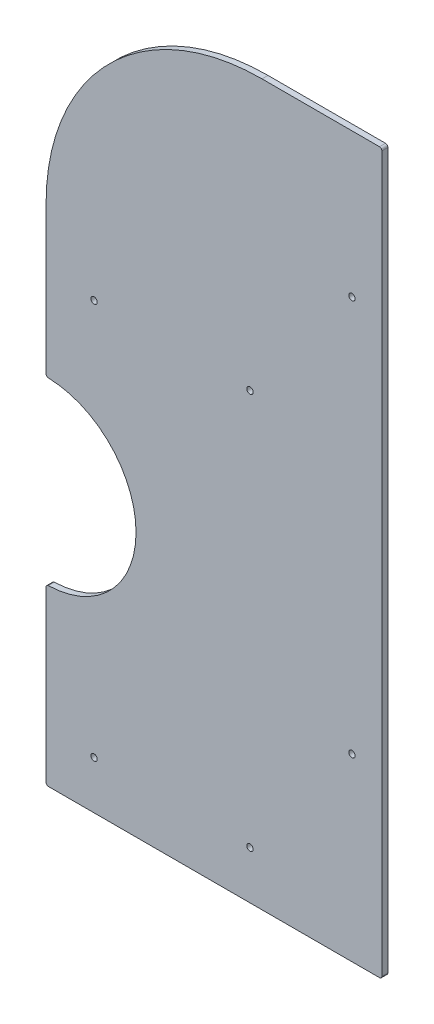
from build123d import *

# Parameters (mm, degrees)
SKETCH1_W           = 355.6
SKETCH1_H           = 762
BOSS_EXTRUDE1_DEPTH = 6.35
FILLET1_R           = 228.6
SKETCH3_R           = 95.25
CUT_EXTRUDE1_DEPTH  = 421.492761531
SKETCH2_R           = 3.3734375
CUT_EXTRUDE2_DEPTH  = 421.492761531
FILLET2_R           = 2.54


with BuildPart() as part:
    # Sketch1 → Boss-Extrude1 (new body)
    with BuildSketch(Plane.XY):
        Rectangle(SKETCH1_W, SKETCH1_H)
    extrude(amount=BOSS_EXTRUDE1_DEPTH)

    # Fillet1
    fillet1_edges = [part.edges().sort_by_distance(p)[0] for p in [
        (-177.8, 381, 3.175),
    ]]
    fillet(fillet1_edges, radius=FILLET1_R)

    # Sketch3 → Cut-Extrude1 (cut, through all)
    with BuildSketch(Plane.XY.offset(6.35)):
        with Locations((-177.8, -101.6)):
            Circle(SKETCH3_R)
    extrude(amount=-CUT_EXTRUDE1_DEPTH, mode=Mode.SUBTRACT)

    # Sketch2 → Cut-Extrude2 (cut, through all)
    with BuildSketch(Plane.XY.offset(6.35)):
        with Locations((146.05, 228.6)):
            Circle(SKETCH2_R)
        with Locations((38.1, 88.9)):
            Circle(SKETCH2_R)
        with Locations((-127, 88.9)):
            Circle(SKETCH2_R)
        with Locations((146.05, -190.5)):
            Circle(SKETCH2_R)
        with Locations((38.1, -330.2)):
            Circle(SKETCH2_R)
        with Locations((-127, -330.2)):
            Circle(SKETCH2_R)
    extrude(amount=-CUT_EXTRUDE2_DEPTH, mode=Mode.SUBTRACT)

    # Fillet2
    fillet2_edges = [part.edges().sort_by_distance(p)[0] for p in [
        (-177.8, -6.35, 3.175),
        (-177.8, -196.85, 3.175),
        (177.8, -381, 3.175),
        (-177.8, -381, 3.175),
        (177.8, 381, 3.175),
    ]]
    fillet(fillet2_edges, radius=FILLET2_R)


solid = part.part
